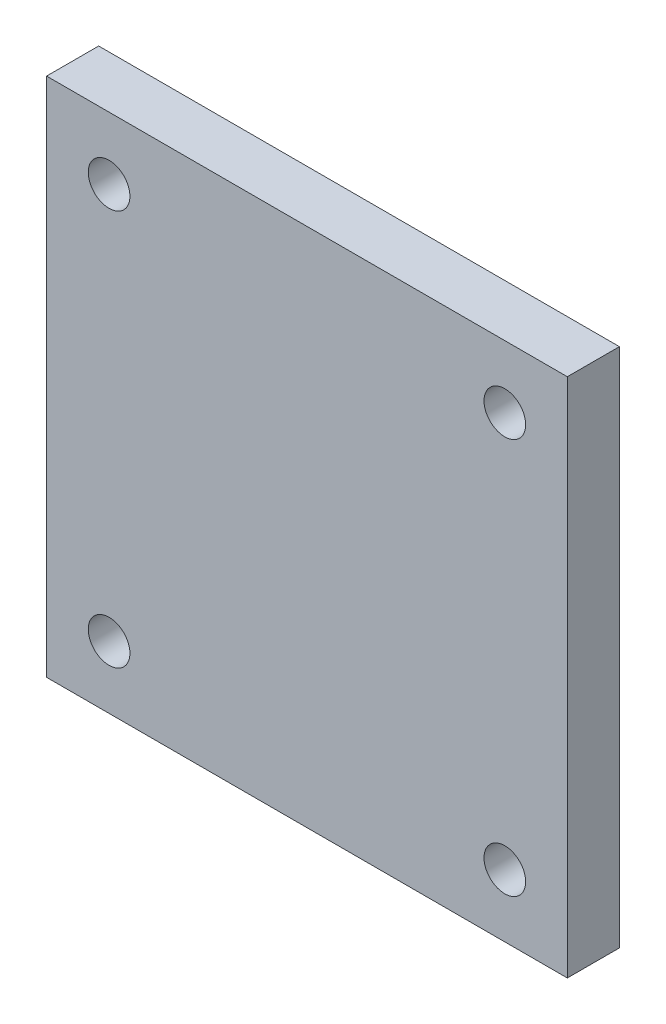
from build123d import *

# Parameters (mm, degrees)
ESQUISSE1_W             = 50
ESQUISSE1_H             = 50
BOSS_EXTRU_1_DEPTH      = 5
ESQUISSE2_R             = 2
ENL_V_MAT_EXTRU_1_DEPTH = 10


with BuildPart() as part:
    # Esquisse1 → Boss.-Extru.1 (new body)
    with BuildSketch(Plane.XY):
        Rectangle(ESQUISSE1_W, ESQUISSE1_H)
    extrude(amount=BOSS_EXTRU_1_DEPTH)

    # Esquisse2 → Enlèv. mat.-Extru.1 (cut)
    with BuildSketch(Plane(origin=(0, 0, 0), x_dir=(-1, 0, 0), z_dir=(0, 0, -1))):
        with Locations((19, 19)):
            Circle(ESQUISSE2_R)
        with Locations((-19, 19)):
            Circle(ESQUISSE2_R)
        with Locations((-19, -19)):
            Circle(ESQUISSE2_R)
        with Locations((19, -19)):
            Circle(ESQUISSE2_R)
    extrude(amount=-ENL_V_MAT_EXTRU_1_DEPTH, mode=Mode.SUBTRACT)


solid = part.part
